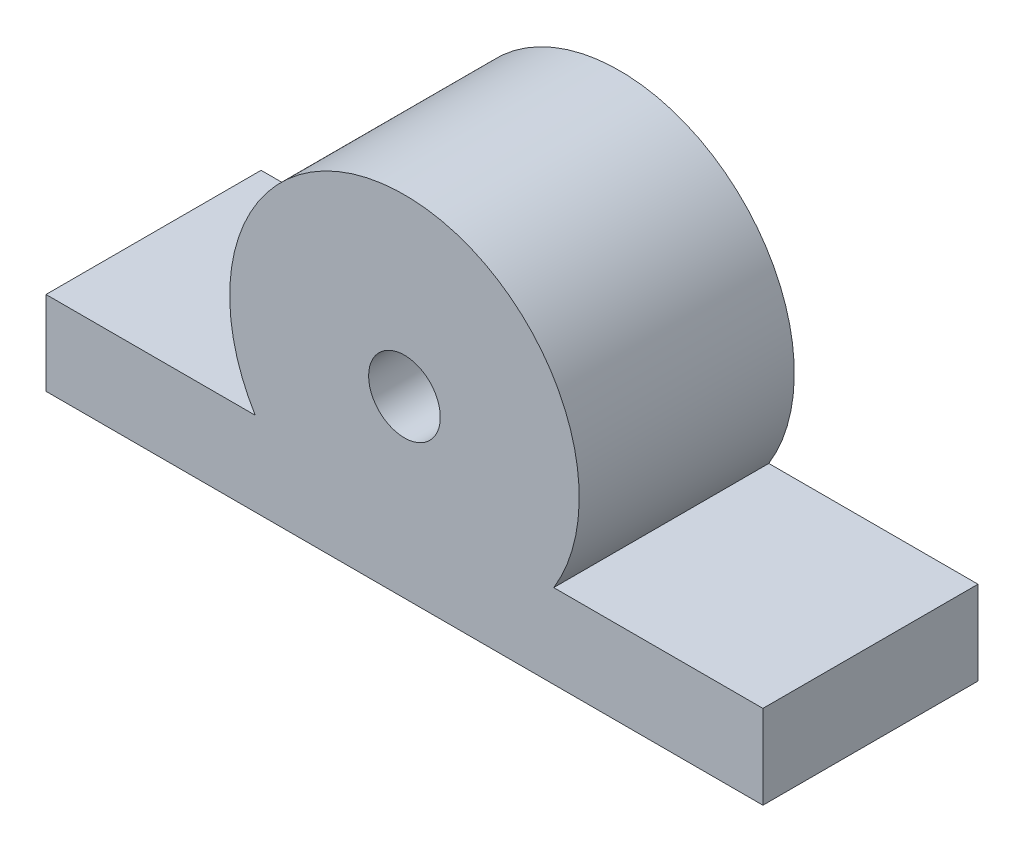
from build123d import *

# Parameters (mm, degrees)
SKETCH2_R           = 6.35
BOSS_EXTRUDE1_DEPTH = 38.1


with BuildPart() as part:
    # Sketch2 → Boss-Extrude1 (new body)
    with BuildSketch(Plane.XY):
        with BuildLine():
            Line((26.443106469, -16.095077953), (63.5, -16.095077953))
            Line((63.5, -16.095077953), (63.5, -30.95625))
            Line((63.5, -30.95625), (-63.5, -30.95625))
            Line((-63.5, -30.95625), (-63.5, -16.095077953))
            Line((-63.5, -16.095077953), (-26.443106469, -16.095077953))
            ThreePointArc((-26.443106469, -16.095077953), (0, 30.95625), (26.443106469, -16.095077953))
        make_face()
        with Locations(Location((0, 0, 0), (0, 0, 180))):
            Circle(SKETCH2_R, mode=Mode.SUBTRACT)
    extrude(amount=BOSS_EXTRUDE1_DEPTH)


solid = part.part
